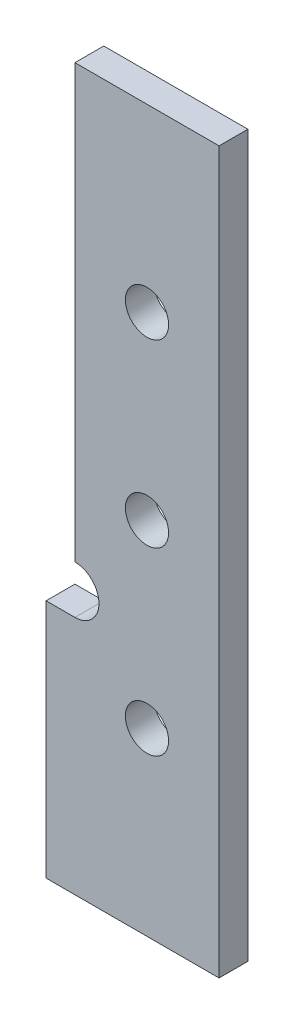
from build123d import *

# Parameters (mm, degrees)
BOSS_EXTRUDE1_DEPTH  = 6
M8_CLEARANCE_HOLE1_D = 9
SKETCH5_R            = 5
CUT_EXTRUDE1_DEPTH   = 105.575331699


with BuildPart() as part:
    # Sketch1 → Boss-Extrude1 (new body)
    with BuildSketch(Plane.XY):
        Polygon((0, 100), (30, 100), (30, -50), (-6, -50), (-6, 0), (0, 0), align=None)
    extrude(amount=BOSS_EXTRUDE1_DEPTH)

    # M8 Clearance Hole1 (through all)
    with Locations(Plane.XY.offset(6)):
        with Locations((15, 62.5), (15, 25), (15, -12.5)):
            Hole(M8_CLEARANCE_HOLE1_D / 2)

    # Sketch5 → Cut-Extrude1 (cut, through all)
    with BuildSketch(Plane(origin=(0, 0, 0), x_dir=(-1, 0, 0), z_dir=(0, 0, -1))):
        with Locations((0, 5)):
            Circle(SKETCH5_R)
    extrude(amount=-CUT_EXTRUDE1_DEPTH, mode=Mode.SUBTRACT)


solid = part.part
